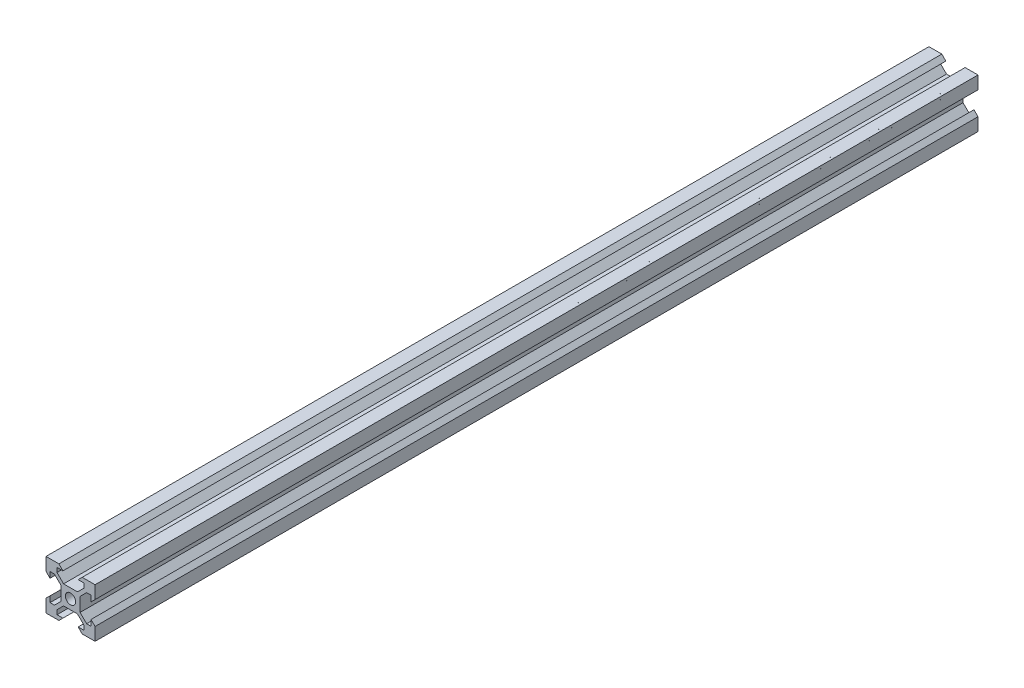
from build123d import *

# Parameters (mm, degrees)
SKETCH1_R           = 2.1
BOSS_EXTRUDE1_DEPTH = 360


with BuildPart() as part:
    # Sketch1 → Boss-Extrude1 (new body)
    with BuildSketch(Plane.XY):
        Polygon((2.834320347, 3.893970342), (5.5, 6.558849663), (5.5, 8.349069506), (3.1, 8.349069506), (4.75, 9.998574117), (10, 9.998574117), (10, 4.746997406), (8.35, 3.097492795), (8.350720674, 5.497492687), (6.560500912, 5.498030255), (3.894821259, 2.833150935), (3.894821259, -2.833150935), (6.560500912, -5.498030255), (8.350720674, -5.497492687), (8.35, -3.097492795), (10, -4.746997406), (10, -9.998574117), (4.75, -9.998574117), (3.1, -8.349069506), (5.5, -8.349069506), (5.5, -6.558849663), (2.834320347, -3.893970342), (-2.834320347, -3.893970342), (-5.5, -6.558849663), (-5.5, -8.349069506), (-3.1, -8.349069506), (-4.75, -9.998574117), (-10, -9.998574117), (-10, -4.746997406), (-8.35, -3.097492795), (-8.350720674, -5.497492687), (-6.560500912, -5.498030255), (-3.894821259, -2.833150935), (-3.894821259, 2.833150935), (-6.560500912, 5.498030255), (-8.350720674, 5.497492687), (-8.35, 3.097492795), (-10, 4.746997406), (-10, 9.998574117), (-4.75, 9.998574117), (-3.1, 8.349069506), (-5.5, 8.349069506), (-5.5, 6.558849663), (-2.834320347, 3.893970342), align=None)
        with Locations(Location((0, 0, 0), (0, 0, 180))):
            Circle(SKETCH1_R, mode=Mode.SUBTRACT)
    extrude(amount=BOSS_EXTRUDE1_DEPTH)


solid = part.part
